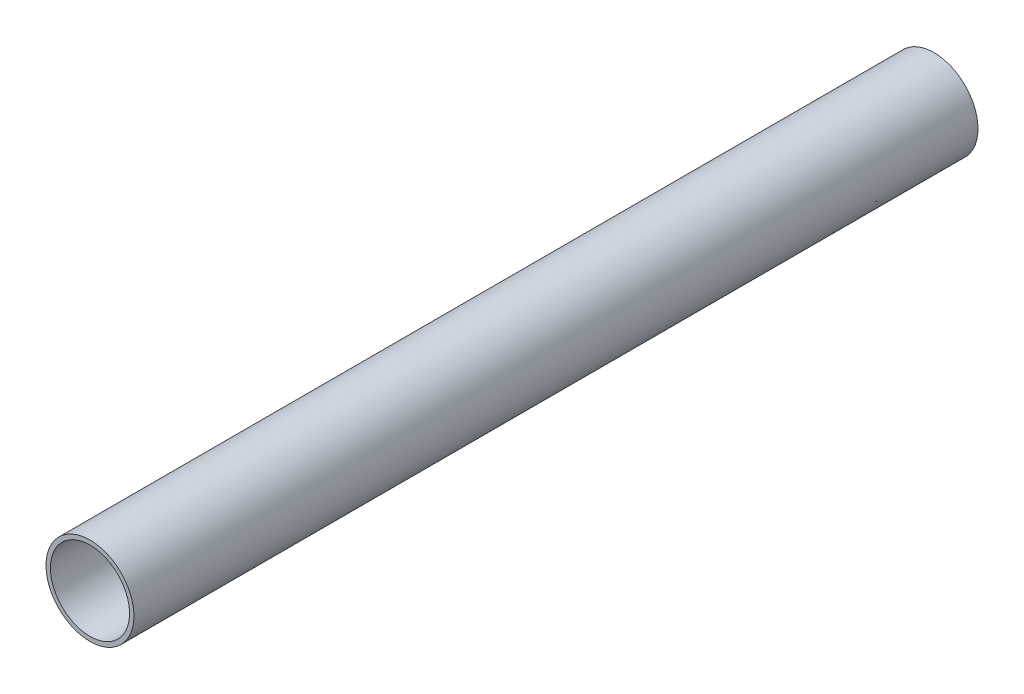
from build123d import *

# Parameters (mm, degrees)
SKETCH1_R               = 15.875
SKETCH1_R_2             = 14.2875
BOSS_EXTRUDE1_DEPTH     = 914.4
CUT_EXTRUDE1_DEPTH      = 915.675566116
CUT_EXTRUDE1_DEPTH_BACK = 915.675566116
SKETCH2_W               = 609.6
SKETCH2_H               = 31.75


with BuildPart() as part:
    # Sketch1 → Boss-Extrude1 (new body)
    with BuildSketch(Plane.XY):
        Circle(SKETCH1_R)
        Circle(SKETCH1_R_2, mode=Mode.SUBTRACT)
    extrude(amount=BOSS_EXTRUDE1_DEPTH)

    # Sketch2 → Cut-Extrude1 (cut, two sides: drawn at the far end of the back side and taken through both)
    with BuildSketch(Plane(origin=(0, 0, 0), x_dir=(0, 0, -1), z_dir=(1, 0, 0)).offset(-CUT_EXTRUDE1_DEPTH_BACK)):
        with Locations((-609.6, 0)):
            Rectangle(SKETCH2_W, SKETCH2_H)
    extrude(amount=CUT_EXTRUDE1_DEPTH + CUT_EXTRUDE1_DEPTH_BACK, mode=Mode.SUBTRACT)


solid = part.part
